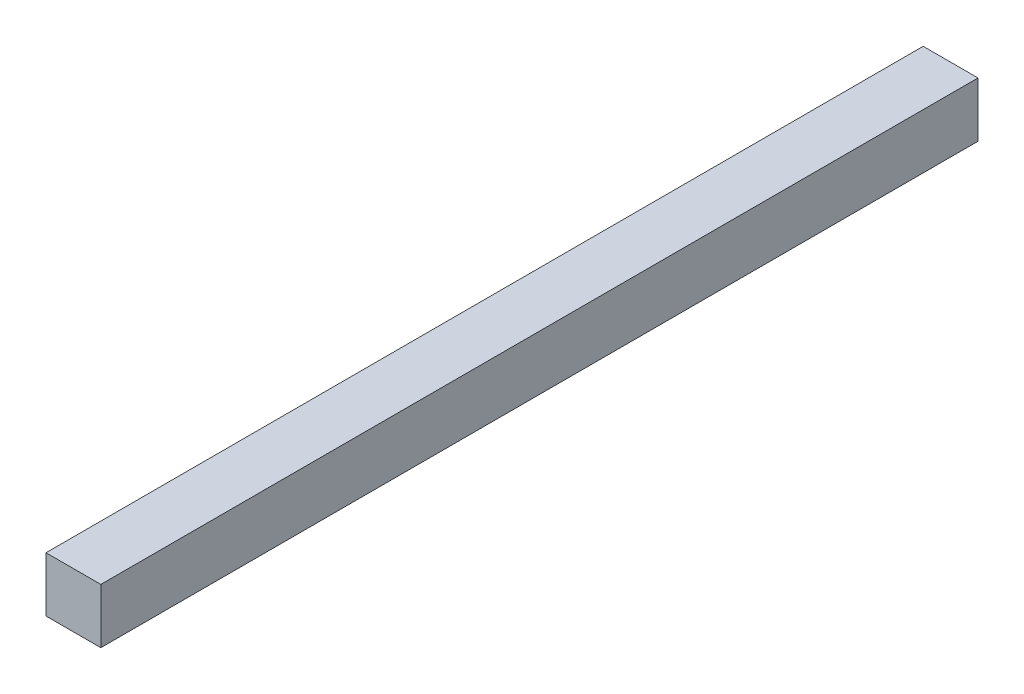
from build123d import *

# Parameters (mm, degrees)
SKETCH1_W           = 25.4
SKETCH1_H           = 25.4
BOSS_EXTRUDE1_DEPTH = 406.4


with BuildPart() as part:
    # Sketch1 → Boss-Extrude1 (new body)
    with BuildSketch(Plane.XY):
        Rectangle(SKETCH1_W, SKETCH1_H)
    extrude(amount=BOSS_EXTRUDE1_DEPTH)


solid = part.part
